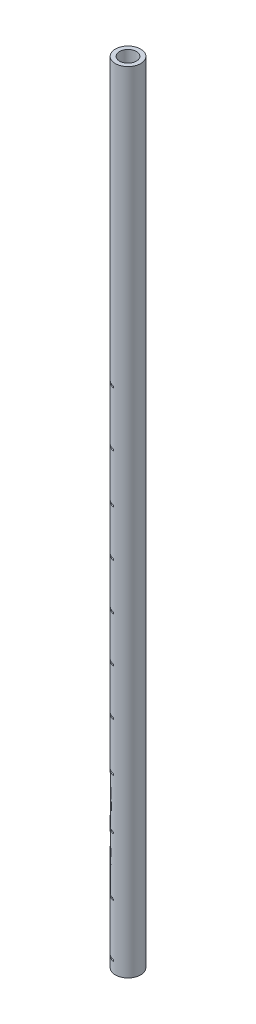
from build123d import *

# Parameters (mm, degrees)
SKETCH_1_R          = 12
SKETCH_1_R_2        = 8
EXTRUDE_1_DEPTH     = 750
SKETCH_2_W          = 10
SKETCH_2_H          = 1.5
CUT_EXTRUDE_1_DEPTH = 20
SKETCH_3_R          = 2
CUT_EXTRUDE_2_DEPTH = 40


with BuildPart() as part:
    # Эскиз1 → Бобышка-Вытянуть1 (new body)
    with BuildSketch(Plane(origin=(0, 0, 0), x_dir=(1, 0, 0), z_dir=(0, 1, 0))):
        with Locations(Location((0, 0, 0), (0, 0, 270))):
            Circle(SKETCH_1_R)
        with Locations(Location((0, 0, 0), (0, 0, 270))):
            Circle(SKETCH_1_R_2, mode=Mode.SUBTRACT)
    extrude(amount=EXTRUDE_1_DEPTH)

    # Эскиз2 → Вырез-Вытянуть1 (cut, symmetric)
    with BuildSketch(Plane.XY):
        with Locations((-7, 10.75)):
            Rectangle(SKETCH_2_W, SKETCH_2_H)
        with Locations((-7, 60.75)):
            Rectangle(SKETCH_2_W, SKETCH_2_H)
        with Locations((-7, 115.75)):
            Rectangle(SKETCH_2_W, SKETCH_2_H)
        with Locations((-7, 163.75)):
            Rectangle(SKETCH_2_W, SKETCH_2_H)
        with Locations((-7, 209.75)):
            Rectangle(SKETCH_2_W, SKETCH_2_H)
        with Locations((-7, 253.75)):
            Rectangle(SKETCH_2_W, SKETCH_2_H)
        with Locations((-7, 296.75)):
            Rectangle(SKETCH_2_W, SKETCH_2_H)
        with Locations((-7, 340.75)):
            Rectangle(SKETCH_2_W, SKETCH_2_H)
        with Locations((-7, 384.75)):
            Rectangle(SKETCH_2_W, SKETCH_2_H)
        with Locations((-7, 430.75)):
            Rectangle(SKETCH_2_W, SKETCH_2_H)
        with Locations((-7, 482.75)):
            Rectangle(SKETCH_2_W, SKETCH_2_H)
    extrude(amount=CUT_EXTRUDE_1_DEPTH, both=True, mode=Mode.SUBTRACT)

    # Эскиз3 → Вырез-Вытянуть2 (cut)
    with BuildSketch(Plane.ZY.offset(2)):
        with Locations((0, 10.75)):
            Circle(SKETCH_3_R)
        with Locations((0, 60.75)):
            Circle(SKETCH_3_R)
        with Locations((0, 115.75)):
            Circle(SKETCH_3_R)
        with Locations((0, 163.75)):
            Circle(SKETCH_3_R)
        with Locations((0, 209.75)):
            Circle(SKETCH_3_R)
        with Locations((0, 253.75)):
            Circle(SKETCH_3_R)
        with Locations((0, 296.75)):
            Circle(SKETCH_3_R)
        with Locations((0, 340.75)):
            Circle(SKETCH_3_R)
        with Locations((0, 384.75)):
            Circle(SKETCH_3_R)
        with Locations((0, 430.75)):
            Circle(SKETCH_3_R)
        with Locations((0, 482.75)):
            Circle(SKETCH_3_R)
    extrude(amount=CUT_EXTRUDE_2_DEPTH, mode=Mode.SUBTRACT)


solid = part.part
